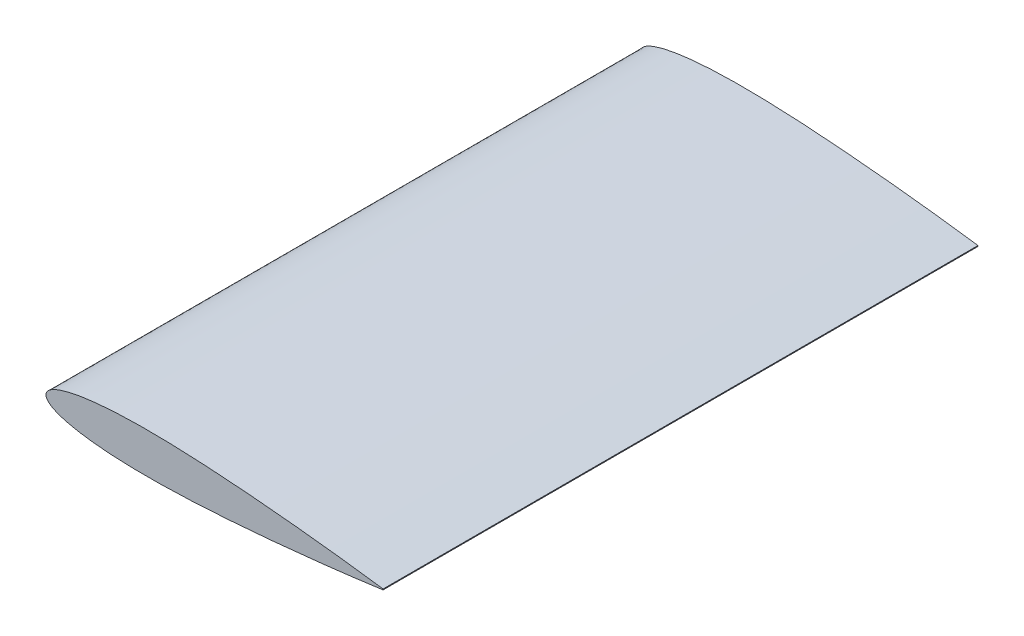
from build123d import *

# Parameters (mm, degrees)
BOSS_EXTRUDE1_DEPTH = 300


with BuildPart() as part:
    # Sketch1 → Boss-Extrude1 (new body)
    with BuildSketch(Plane.XY):
        with BuildLine():
            Line((170, 0.2142), (170, -0.2142))
            add(Edge.make_bspline(
                [(170, 0.2142), (169.96691342, 0.218840619), (169.834646413, 0.237391972), (169.537333236, 0.279024137), (169.042585815, 0.348138554), (168.351556262, 0.444222957), (167.465861685, 0.566675287), (166.387568835, 0.714696442), (165.119197415, 0.887397871), (163.663702113, 1.083622861), (162.024490194, 1.302244578), (160.205382022, 1.541876743), (158.210634282, 1.801225039), (156.044893294, 2.078728885), (153.713221626, 2.372926959), (150.289057759, 2.797861008), (146.662395353, 3.235863882), (142.841697446, 3.684291554), (139.769351121, 4.037499855), (136.569100778, 4.397549669), (132.068788222, 4.892266007), (127.422978073, 5.384378087), (121.375060844, 5.999625203), (116.361049701, 6.487216835), (111.246606258, 6.959992239), (107.31337029, 7.310092358), (103.328024652, 7.650341722), (99.299870496, 7.978732727), (95.238314948, 8.293055446), (91.152846167, 8.591268853), (87.053004363, 8.871082509), (82.948358141, 9.13033403), (78.848497392, 9.366803888), (74.762993375, 9.578311692), (70.701379602, 9.762701033), (66.673140916, 9.917914682), (62.687682017, 10.041902075), (58.754319968, 10.132910693), (54.882226278, 10.189181523), (51.080441726, 10.209173885), (47.357843858, 10.191610864), (43.723124833, 10.135446531), (40.184769339, 10.039770769), (36.751031834, 9.904098329), (33.429929756, 9.728148284), (30.229218443, 9.511905171), (27.156354465, 9.255709661), (24.218493071, 8.960193372), (21.422491655, 8.626124422), (18.774841867, 8.254741447), (16.281708623, 7.847260375), (13.948834696, 7.405401505), (11.781627403, 6.930718554), (9.785010864, 6.425204715), (7.96352359, 5.890657841), (6.321164006, 5.329128456), (4.861440512, 4.742481339), (3.587256905, 4.132452641), (2.500860336, 3.500441188), (1.603848063, 2.847161059), (0.897528539, 2.171977334), (0.384178046, 1.472535432), (0.070036308, 0.74578498), (-0.034140779, 0), (0.070036308, -0.74578498), (0.384178046, -1.472535432), (0.897528539, -2.171977334), (1.603848063, -2.847161059), (2.500860336, -3.500441188), (3.587256905, -4.132452641), (4.861440512, -4.742481339), (6.321164006, -5.329128456), (7.96352359, -5.890657841), (9.785010864, -6.425204715), (11.781627403, -6.930718554), (13.948834696, -7.405401505), (16.281708623, -7.847260375), (18.774841867, -8.254741447), (21.422491655, -8.626124422), (24.218493071, -8.960193372), (27.156354465, -9.255709661), (30.229218443, -9.511905171), (33.429929756, -9.728148284), (36.751031834, -9.904098329), (40.184769339, -10.039770769), (43.723124833, -10.135446531), (47.357843858, -10.191610864), (51.080441726, -10.209173885), (54.882226278, -10.189181523), (58.754319968, -10.132910693), (62.687682017, -10.041902075), (66.673140916, -9.917914682), (70.701379602, -9.762701033), (74.762993375, -9.578311692), (78.848497392, -9.366803888), (82.948358141, -9.13033403), (87.053004363, -8.871082509), (91.152846167, -8.591268853), (95.238314948, -8.293055446), (99.299870496, -7.978732727), (103.328024652, -7.650341722), (107.31337029, -7.310092358), (111.246606258, -6.959992239), (116.361049701, -6.487216835), (121.375060844, -5.999625203), (127.422978073, -5.384378087), (132.068788222, -4.892266007), (136.569100778, -4.397549669), (139.769351121, -4.037499855), (143.774710008, -3.577028977), (147.594918, -3.1243829), (151.221066258, -2.682200029), (153.713221626, -2.372926959), (156.044893294, -2.078728885), (158.210634282, -1.801225039), (160.205382022, -1.541876743), (162.024490194, -1.302244578), (163.663702113, -1.083622861), (165.119197415, -0.887397871), (166.387568835, -0.714696442), (167.465861685, -0.566675287), (168.351556262, -0.444222957), (169.042585815, -0.348138554), (169.537333236, -0.279024137), (169.834646413, -0.237391972), (169.96691342, -0.218840619), (170, -0.2142)],
                knots=[0, 0, 0, 0, 0.000289136, 0.001155852, 0.002598072, 0.004612291, 0.007193602, 0.010335843, 0.014031423, 0.018271458, 0.023045751, 0.028342883, 0.034150144, 0.040453722, 0.047238578, 0.054488567, 0.070313963, 0.078851952, 0.087780082, 0.097077365, 0.106721842, 0.126960673, 0.1375073, 0.159330995, 0.170556744, 0.181956674, 0.193504, 0.205171592, 0.216932161, 0.228757981, 0.240621468, 0.252494876, 0.264350496, 0.276160728, 0.287898242, 0.299535934, 0.311046961, 0.32240503, 0.333584247, 0.344559424, 0.355305888, 0.365799654, 0.376017641, 0.38593752, 0.395537818, 0.404798063, 0.413698789, 0.422221673, 0.430349467, 0.438066139, 0.445357153, 0.452209429, 0.458611496, 0.464554007, 0.470029929, 0.475035083, 0.479569168, 0.483636909, 0.487250212, 0.4904315, 0.49321883, 0.495674081, 0.497891233, 0.5, 0.502108767, 0.504325919, 0.50678117, 0.5095685, 0.512749788, 0.516363091, 0.520430832, 0.524964917, 0.529970071, 0.535445993, 0.541388504, 0.547790571, 0.554642847, 0.561933861, 0.569650533, 0.577778327, 0.586301211, 0.595201937, 0.604462182, 0.61406248, 0.623982359, 0.634200346, 0.644694112, 0.655440576, 0.666415753, 0.67759497, 0.688953039, 0.700464066, 0.712101758, 0.723839272, 0.735649504, 0.747505124, 0.759378532, 0.771242019, 0.783067839, 0.794828408, 0.806496, 0.818043326, 0.829443256, 0.840669005, 0.8624927, 0.873039327, 0.893278158, 0.902922635, 0.912219918, 0.921148048, 0.937813568, 0.945511433, 0.952761422, 0.959546278, 0.965849856, 0.971657117, 0.976954249, 0.981728542, 0.985968577, 0.989664157, 0.992806398, 0.995387709, 0.997401928, 0.998844148, 0.999710864, 1, 1, 1, 1], degree=3))
        make_face()
    extrude(amount=BOSS_EXTRUDE1_DEPTH)


solid = part.part
